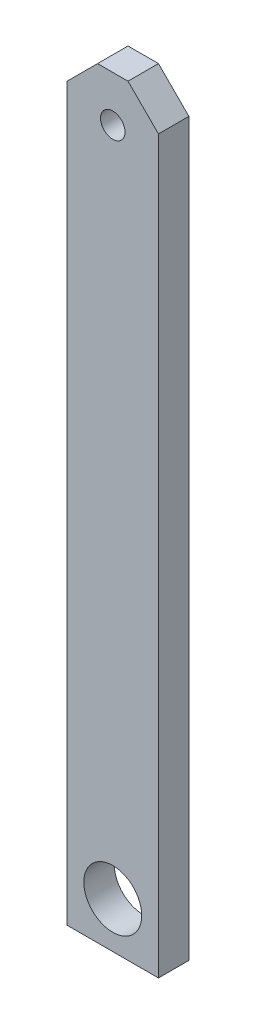
from build123d import *

# Parameters (mm, degrees)
SKETCH1_W                    = 19.05
SKETCH1_H                    = 158.75
BOSS_EXTRUDE1_DEPTH          = 6.35
F_1_4_20_TAPPED_HOLE1_D      = 5.1054
F_1_4_0_475_DIAMETER_HOLE1_D = 12.065
CHAMFER1_SIZE                = 6.35


with BuildPart() as part:
    # Sketch1 → Boss-Extrude1 (new body)
    with BuildSketch(Plane.XY):
        with Locations((9.525, 79.375)):
            Rectangle(SKETCH1_W, SKETCH1_H)
    extrude(amount=BOSS_EXTRUDE1_DEPTH)

    # 1/4-20 Tapped Hole1 (through all)
    with Locations(Plane.XY.offset(6.35)):
        with Locations((9.525, 149.225)):
            Hole(F_1_4_20_TAPPED_HOLE1_D / 2)

    # 1/4 (0.475) Diameter Hole1 (through all)
    with Locations(Plane.XY.offset(6.35)):
        with Locations((9.525, 9.525)):
            Hole(F_1_4_0_475_DIAMETER_HOLE1_D / 2)

    # Chamfer1
    chamfer1_edges = [part.edges().sort_by_distance(p)[0] for p in [
        (0, 158.75, 3.175),
        (19.05, 158.75, 3.175),
    ]]
    chamfer(chamfer1_edges, length=CHAMFER1_SIZE)


solid = part.part
